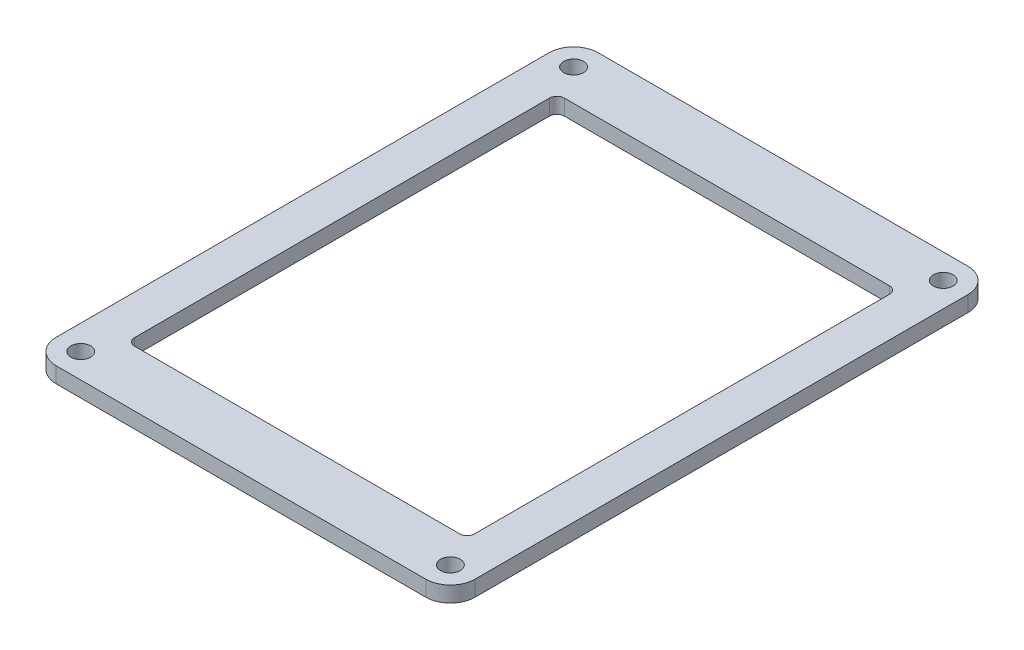
from build123d import *

# Parameters (mm, degrees)
SKETCH1_W           = 85
SKETCH1_H           = 110
BOSS_EXTRUDE1_DEPTH = 3.175
FILLET1_R           = 5
SKETCH3_W           = 68.982
SKETCH3_H           = 87.204
CUT_EXTRUDE3_DEPTH  = 140.050640506
FILLET2_R           = 1.5
SKETCH5_R           = 2
CUT_EXTRUDE4_DEPTH  = 140.050640506


with BuildPart() as part:
    # Sketch1 → Boss-Extrude1 (new body)
    with BuildSketch(Plane(origin=(0, 0, 0), x_dir=(1, 0, 0), z_dir=(0, 1, 0))):
        with Locations((42.5, 55)):
            Rectangle(SKETCH1_W, SKETCH1_H)
    extrude(amount=BOSS_EXTRUDE1_DEPTH)

    # Fillet1
    fillet1_edges = [part.edges().sort_by_distance(p)[0] for p in [
        (0, 1.5875, -110),
        (85, 1.5875, -110),
        (85, 1.5875, 0),
        (0, 1.5875, 0),
    ]]
    fillet(fillet1_edges, radius=FILLET1_R)

    # Sketch3 → Cut-Extrude3 (cut, through all)
    with BuildSketch(Plane(origin=(0, 3.175, 0), x_dir=(1, 0, 0), z_dir=(0, 1, 0))):
        with Locations((42.5, 55)):
            Rectangle(SKETCH3_W, SKETCH3_H)
    extrude(amount=-CUT_EXTRUDE3_DEPTH, mode=Mode.SUBTRACT)

    # Fillet2
    fillet2_edges = [part.edges().sort_by_distance(p)[0] for p in [
        (76.991, 1.5875, -98.602),
        (76.991, 1.5875, -11.398),
        (8.009, 1.5875, -11.398),
        (8.009, 1.5875, -98.602),
    ]]
    fillet(fillet2_edges, radius=FILLET2_R)

    # Sketch5 → Cut-Extrude4 (cut, through all)
    with BuildSketch(Plane(origin=(0, 3.175, 0), x_dir=(1, 0, 0), z_dir=(0, 1, 0))):
        with Locations(Location((5, 5, 0), (0, 0, 270))):
            Circle(SKETCH5_R)
        with Locations(Location((80, 5, 0), (0, 0, 270))):
            Circle(SKETCH5_R)
        with Locations(Location((80, 105, 0), (0, 0, 270))):
            Circle(SKETCH5_R)
        with Locations(Location((5, 105, 0), (0, 0, 270))):
            Circle(SKETCH5_R)
    extrude(amount=-CUT_EXTRUDE4_DEPTH, mode=Mode.SUBTRACT)


solid = part.part
